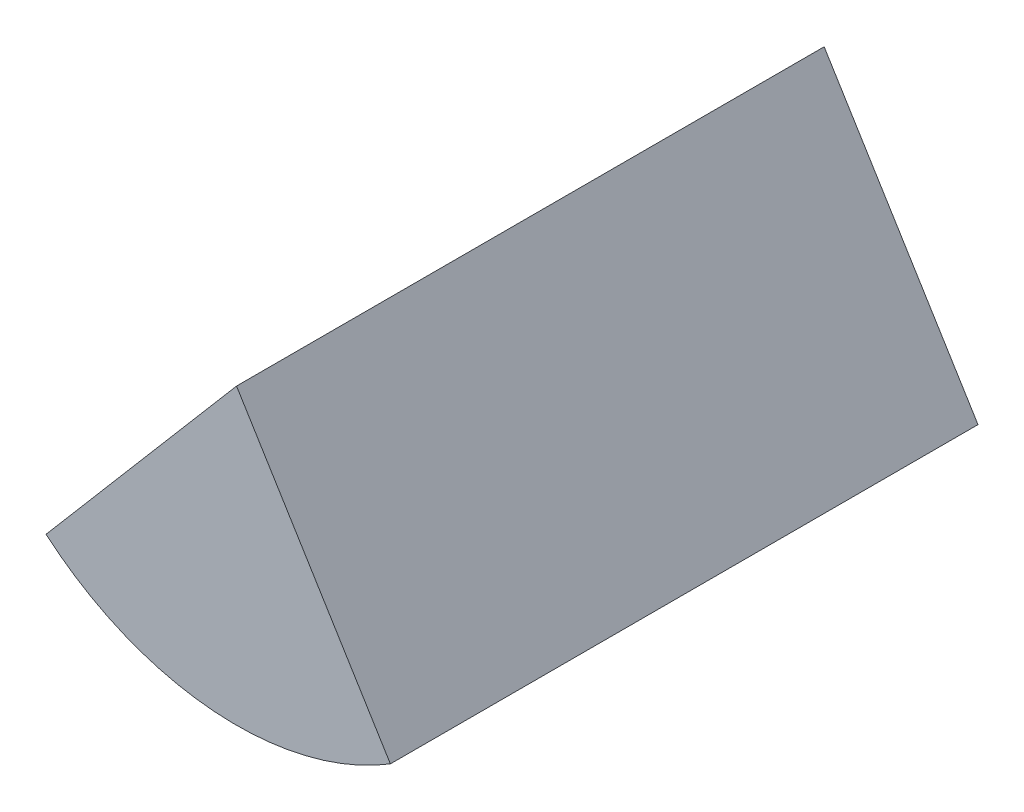
from build123d import *

# Parameters (mm, degrees)
SALIENTE_EXTRUIR1_DEPTH = 50
CROQUIS2_R              = 5
CORTAR_EXTRUIR1_DEPTH   = 10


with BuildPart() as part:
    # Croquis1 → Saliente-Extruir1 (new body)
    with BuildSketch(Plane.XY):
        with BuildLine():
            Line((0, 0), (13.090017928, -21.299094597))
            ThreePointArc((13.090017928, -21.299094597), (-1.92924673, -24.925448984), (-16.211604711, -19.031129044))
            Line((-16.211604711, -19.031129044), (0, 0))
        make_face()
    extrude(amount=SALIENTE_EXTRUIR1_DEPTH)

    # Croquis2 → Cortar-Extruir1 (cut)
    with BuildSketch(Plane(origin=(0, 0, 0), x_dir=(-1, 0, 0), z_dir=(0, 0, -1))):
        with Locations((1.177509742, -15.909954548)):
            Circle(CROQUIS2_R)
    extrude(amount=-CORTAR_EXTRUIR1_DEPTH, mode=Mode.SUBTRACT)


solid = part.part
